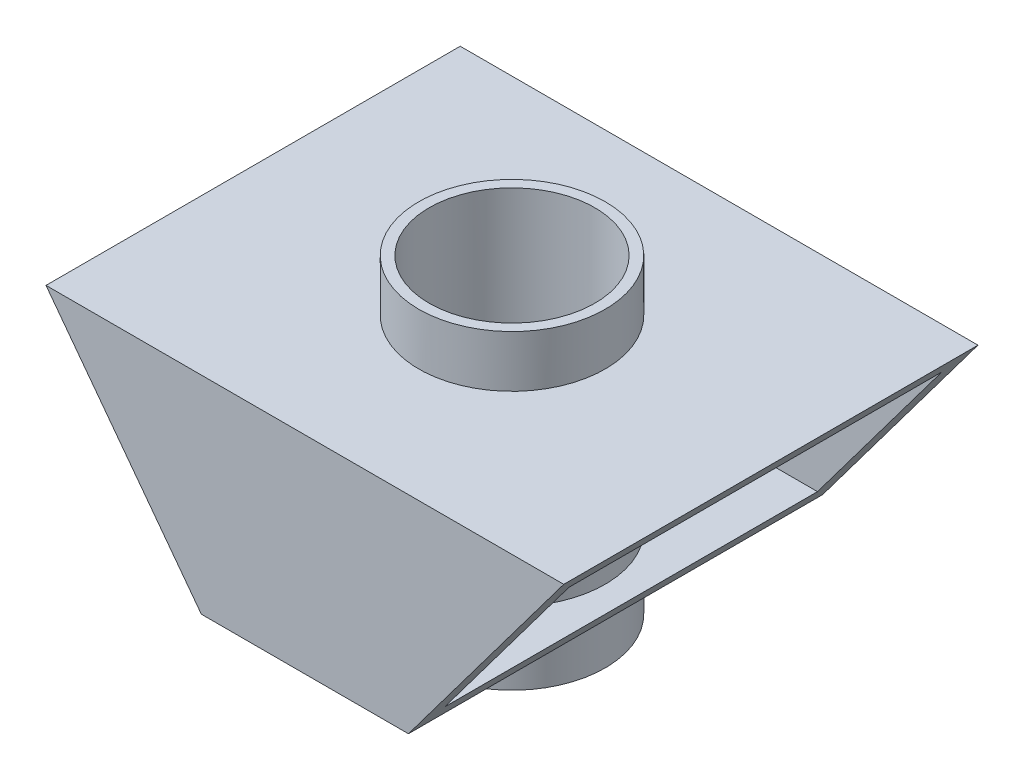
from build123d import *

# Parameters (mm, degrees)
SKETCH1_W                = 50
SKETCH1_H                = 40
BOSS_EXTRUDE1_DEPTH      = 20
SKETCH2_W                = 36
SKETCH2_H                = 16
CUT_EXTRUDE1_DEPTH       = 50
CUT_EXTRUDE2_REACH       = 53.235
BOSS_EXTRUDE2_DEPTH      = 5
BOSS_EXTRUDE2_DEPTH_BACK = 25
SKETCH5_R                = 9
BOSS_EXTRUDE3_START      = -19
SKETCH8_R                = 9
BOSS_EXTRUDE3_DEPTH      = 19
SKETCH9_R                = 8
CUT_EXTRUDE4_DEPTH       = 30


with BuildPart() as part:
    # Sketch1 → Boss-Extrude1 (new body)
    with BuildSketch(Plane(origin=(0, 0, 0), x_dir=(1, 0, 0), z_dir=(0, 1, 0))):
        Rectangle(SKETCH1_W, SKETCH1_H)
    extrude(amount=BOSS_EXTRUDE1_DEPTH)

    # Sketch2 → Cut-Extrude1 (cut)
    with BuildSketch(Plane(origin=(25, 0, 0), x_dir=(0, 0, -1), z_dir=(1, 0, 0))):
        with Locations((0, 10)):
            Rectangle(SKETCH2_W, SKETCH2_H)
    extrude(amount=-CUT_EXTRUDE1_DEPTH, mode=Mode.SUBTRACT)

    # Cut-Extrude2: up to this face of the body (flat: up to its plane)
    cut_extrude2_end = Plane(part.part.faces().sort_by_distance((0, 10, -20))[0])
    # Sketch3 → Cut-Extrude2 (cut, up to the picked face)
    with BuildSketch(Plane.XY.offset(20), mode=Mode.PRIVATE) as cut_extrude2_sk1:
        Polygon((25, 0), (25, 20), (10, 0), align=None)
    cut_extrude2_tool1 = split(extrude(cut_extrude2_sk1.sketch, amount=-CUT_EXTRUDE2_REACH, mode=Mode.PRIVATE), bisect_by=cut_extrude2_end, keep=Keep.BOTH, mode=Mode.PRIVATE)
    # Sketch3 → Cut-Extrude2 (cut, up to the picked face)
    with BuildSketch(Plane.XY.offset(20), mode=Mode.PRIVATE) as cut_extrude2_sk2:
        Polygon((-10, 0), (-25, 20), (-25, 0), align=None)
    cut_extrude2_tool2 = split(extrude(cut_extrude2_sk2.sketch, amount=-CUT_EXTRUDE2_REACH, mode=Mode.PRIVATE), bisect_by=cut_extrude2_end, keep=Keep.BOTH, mode=Mode.PRIVATE)
    add(cut_extrude2_tool1.solids().sort_by(Axis((20, 6.666667, 20), (0, 0, -1)))[0], mode=Mode.SUBTRACT)
    add(cut_extrude2_tool2.solids().sort_by(Axis((-20, 6.666667, 20), (0, 0, -1)))[0], mode=Mode.SUBTRACT)

    # Sketch5 → Boss-Extrude2 (add, two sides: drawn at the far end of the back side and taken through both)
    with BuildSketch(Plane(origin=(0, 20, 0), x_dir=(1, 0, 0), z_dir=(0, 1, 0)).offset(-BOSS_EXTRUDE2_DEPTH_BACK)):
        with Locations(Location((0, 0, 0), (0, 0, 90))):
            Circle(SKETCH5_R)
    extrude(amount=BOSS_EXTRUDE2_DEPTH + BOSS_EXTRUDE2_DEPTH_BACK)

    # Sketch8 → Boss-Extrude3 (add)
    with BuildSketch(Plane(origin=(0, -5, 0), x_dir=(-1, 0, 0), z_dir=(0, -1, 0)).offset(BOSS_EXTRUDE3_START)):
        with Locations(Location((0, 0, 0), (0, 0, 90))):
            Circle(SKETCH8_R)
    extrude(amount=BOSS_EXTRUDE3_DEPTH)

    # Sketch9 → Cut-Extrude4 (cut)
    with BuildSketch(Plane(origin=(0, 25, 0), x_dir=(1, 0, 0), z_dir=(0, 1, 0))):
        with Locations(Location((0, 0, 0), (0, 0, 270))):
            Circle(SKETCH9_R)
    extrude(amount=-CUT_EXTRUDE4_DEPTH, mode=Mode.SUBTRACT)


solid = part.part
